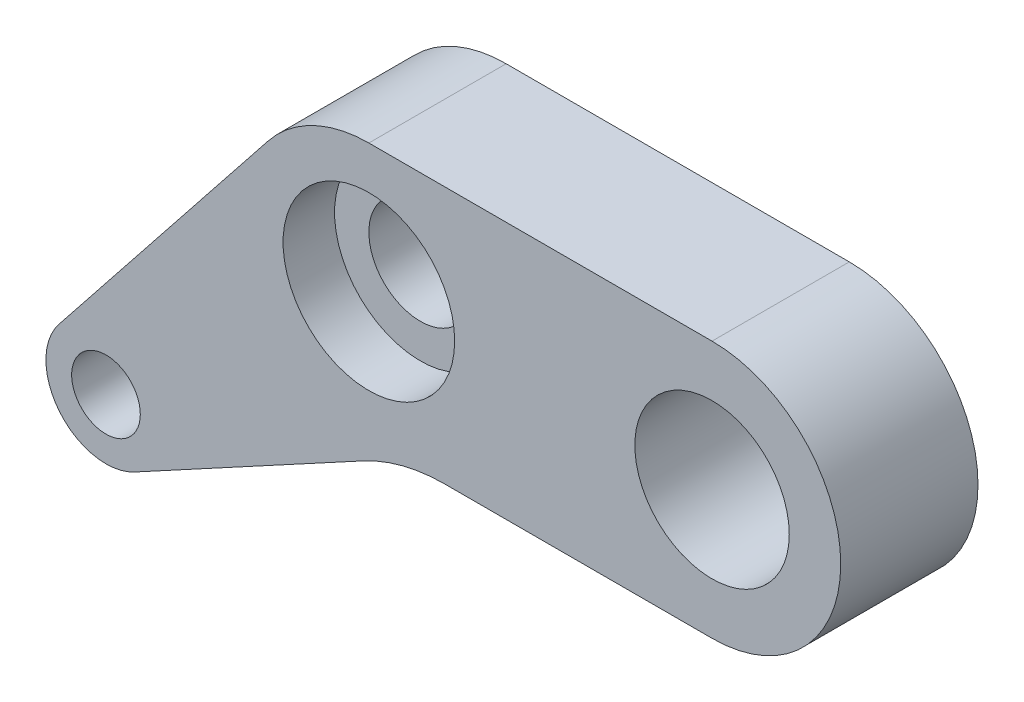
from build123d import *

# Parameters (mm, degrees)
SKETCH_1_R          = 3.5
SKETCH_1_R_2        = 2
SKETCH_1_R_3        = 7.5
SKETCH_1_R_4        = 3
SKETCH_1_R_5        = 4.5
EXTRUDE_1_DEPTH     = 8
FILLET_1_R          = 10
SKETCH_2_R          = 5
CUT_EXTRUDE_1_DEPTH = 3


with BuildPart() as part:
    # Эскиз1 → Бобышка-Вытянуть1 (new body)
    # profile 1 of 6: a face of its own
    with BuildSketch(Plane.XY):
        with Locations((-35.320888862, -12.855752194)):
            Circle(SKETCH_1_R)
        with Locations((-35.320888862, -12.855752194)):
            Circle(SKETCH_1_R_2, mode=Mode.SUBTRACT)
    # profile 2 of 6: a face of its own
    with BuildSketch(Plane.XY):
        with BuildLine():
            ThreePointArc((-20, -7.5), (-26.754185537, -3.260518017), (-25.872571635, 4.665072603))
            Line((-25.872571635, 4.665072603), (-38.061422292, -10.678718312))
            ThreePointArc((-38.061422292, -10.678718312), (-34.168037398, -9.551068623), (-31.820888862, -12.855752194))
            ThreePointArc((-31.820888862, -12.855752194), (-32.313543751, -14.646248042), (-33.652817653, -15.932688729))
            Line((-33.652817653, -15.932688729), (-18.097817426, -7.5))
            Line((-18.097817426, -7.5), (-20, -7.5))
        make_face()
    # profile 3 of 6: a face of its own
    with BuildSketch(Plane.XY):
        with Locations((-20, 0)):
            Circle(SKETCH_1_R_3)
        with Locations((-20, 0)):
            Circle(SKETCH_1_R_4, mode=Mode.SUBTRACT)
    # profile 4 of 6: a face of its own
    with BuildSketch(Plane.XY):
        with BuildLine():
            Line((-20, -7.5), (-18.097817426, -7.5))
            Line((-18.097817426, -7.5), (-16.425561695, -6.593435432))
            ThreePointArc((-16.425561695, -6.593435432), (-18.156194932, -7.26982688), (-20, -7.5))
        make_face()
    # profile 5 of 6: a face of its own
    with BuildSketch(Plane.XY):
        with BuildLine():
            ThreePointArc((0, -7.5), (-7.5, 0), (0, 7.5))
            Line((0, 7.5), (-20, 7.5))
            ThreePointArc((-20, 7.5), (-14.696699141, 5.303300859), (-12.5, 0))
            ThreePointArc((-12.5, 0), (-13.555689048, -3.836776818), (-16.425561695, -6.593435432))
            Line((-16.425561695, -6.593435432), (-18.097817426, -7.5))
            Line((-18.097817426, -7.5), (0, -7.5))
        make_face()
    # profile 6 of 6: a face of its own
    with BuildSketch(Plane.XY):
        Circle(SKETCH_1_R_3)
        Circle(SKETCH_1_R_5, mode=Mode.SUBTRACT)
    extrude(amount=EXTRUDE_1_DEPTH)

    # Скругление1
    fillet_1_edges = [part.edges().sort_by_distance(p)[0] for p in [
        (-18.097817426, -7.5, 4),
    ]]
    fillet(fillet_1_edges, radius=FILLET_1_R)

    # Эскиз2 → Вырез-Вытянуть1 (cut)
    with BuildSketch(Plane.XY.offset(8)):
        with Locations((-20, 0)):
            Circle(SKETCH_2_R)
    extrude(amount=-CUT_EXTRUDE_1_DEPTH, mode=Mode.SUBTRACT)


solid = part.part
